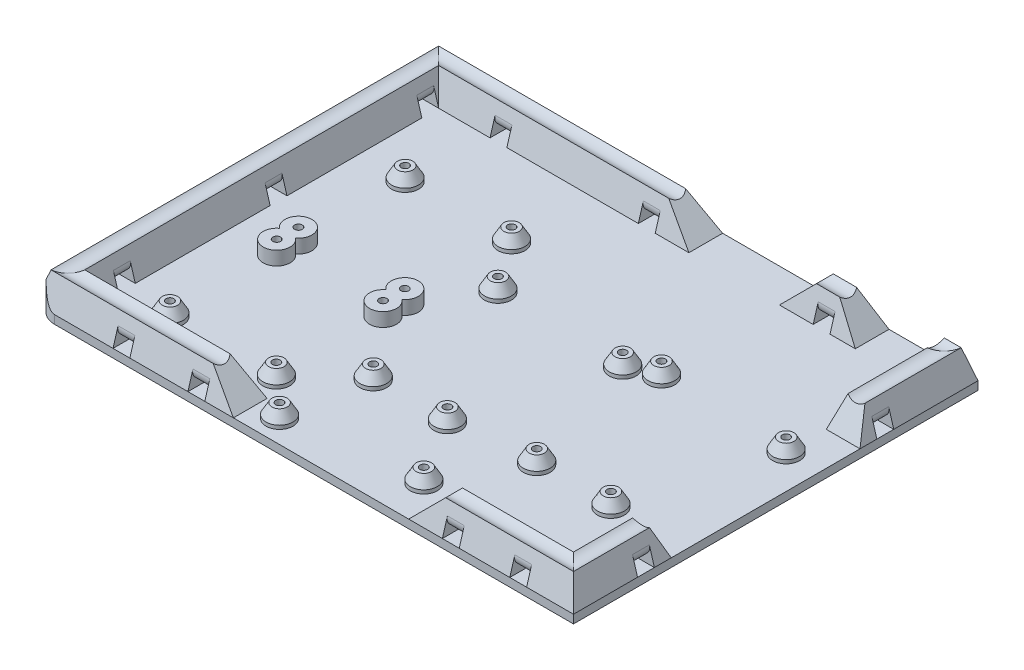
from build123d import *
from OCP.BRepFilletAPI import BRepFilletAPI_MakeChamfer

# Parameters (mm, degrees)
SKETCH1_W                       = 203.2
SKETCH1_H                       = 152.4
BOSS_EXTRUDE1_DEPTH             = 3.175
SKETCH2_R                       = 1.5875
SKETCH2_R_2                     = 1.5
CUT_EXTRUDE1_DEPTH              = 183.633442891
BOSS_EXTRUDE2_REACH             = 184.633
SKETCH3_R                       = 5.08
SKETCH3_R_2                     = 1.45
BOSS_EXTRUDE2_DIRECTION_2_DEPTH = 5.1816
CHAMFER1_SIZE                   = 3.81
CHAMFER1_SIZE2                  = 2.199704526
BOSS_EXTRUDE3_DEPTH             = 152.4
CUT_EXTRUDE3_REACH              = 252.771
SKETCH7_W                       = 6.35
SKETCH7_H                       = 2.54
CUT_EXTRUDE4_DEPTH              = 183.923220329
BOSS_EXTRUDE4_REACH             = 183.774
CUT_EXTRUDE5_REACH              = 203.769
CUT_EXTRUDE6_REACH              = 203.769
SKETCH11_W                      = 6.35
SKETCH11_H                      = 2.54
BOSS_EXTRUDE5_REACH             = 196.979
CUT_EXTRUDE7_REACH              = 203.769
SKETCH13_W                      = 6.35
SKETCH13_H                      = 2.54
BOSS_EXTRUDE6_START             = -62.103
BOSS_EXTRUDE6_DEPTH             = 62.103
CUT_EXTRUDE8_DEPTH              = 183.923220329
CUT_EXTRUDE9_REACH              = 203.769
SKETCH16_W                      = 6.35
SKETCH16_H                      = 2.54
CUT_EXTRUDE10_REACH             = 203.769
CUT_EXTRUDE11_REACH             = 203.769
BOSS_EXTRUDE7_REACH             = 177.617
BOSS_EXTRUDE8_REACH             = 172.699
CUT_EXTRUDE12_REACH             = 252.771
SKETCH21_W                      = 6.35
SKETCH21_H                      = 2.54
FILLET2_R                       = 3.048
SKETCH22_R                      = 1.5875
CUT_EXTRUDE13_DEPTH             = 12.7
CUT_EXTRUDE14_REACH             = 252.771
CUT_EXTRUDE16_REACH             = 203.769
CUT_EXTRUDE17_REACH             = 238.693
FILLET3_R                       = 7.62


with BuildPart() as part:
    # Sketch1 → Boss-Extrude1 (new body)
    with BuildSketch(Plane(origin=(0, 39.60898566, 0), x_dir=(-1, 0, 0), z_dir=(0, -1, 0))):
        with Locations((-19.300561031, -60.650093823)):
            Rectangle(SKETCH1_W, SKETCH1_H)
    extrude(amount=-BOSS_EXTRUDE1_DEPTH)

    # Sketch2 → Cut-Extrude1 (cut, through all)
    with BuildSketch(Plane(origin=(0, 42.78398566, 0), x_dir=(1, 0, 0), z_dir=(0, 1, 0))):
        with Locations(Location((65.147561031, -94.940093823, 0), (0, 0, 180))):
            Circle(SKETCH2_R)
        with Locations(Location((93.087561031, -94.940093823, 0), (0, 0, 180))):
            Circle(SKETCH2_R)
        with Locations(Location((60.067561031, -42.870093823, 0), (0, 0, 180))):
            Circle(SKETCH2_R)
        with Locations(Location((108.327561031, -44.140093823, 0), (0, 0, 180))):
            Circle(SKETCH2_R)
        with Locations(Location((49.907561031, -47.315093823, 0), (0, 0, 180))):
            Circle(SKETCH2_R)
        with Locations(Location((49.907561031, -122.245093823, 0), (0, 0, 180))):
            Circle(SKETCH2_R)
        with Locations(Location((34.667561031, -98.115093823, 0), (0, 0, 180))):
            Circle(SKETCH2_R)
        with Locations(Location((1.647561031, -128.341093823, 0), (0, 0, 180))):
            Circle(SKETCH2_R)
        with Locations(Location((6.727561031, -98.115093823, 0), (0, 0, 180))):
            Circle(SKETCH2_R)
        with Locations(Location((-12.119238969, -115.793493823, 0), (0, 0, 180))):
            Circle(SKETCH2_R_2)
        with Locations(Location((-12.119238969, -75.585293823, 0), (0, 0, 180))):
            Circle(SKETCH2_R_2)
        with Locations(Location((1.647561031, -46.045093823, 0), (0, 0, 180))):
            Circle(SKETCH2_R)
        with Locations(Location((-11.941438969, -67.558893823, 0), (0, 0, 180))):
            Circle(SKETCH2_R_2)
        with Locations(Location((-11.941438969, -27.350693823, 0), (0, 0, 180))):
            Circle(SKETCH2_R_2)
        with Locations(Location((-52.200438969, -115.793493823, 0), (0, 0, 180))):
            Circle(SKETCH2_R_2)
        with Locations(Location((-52.200438969, -75.585293823, 0), (0, 0, 180))):
            Circle(SKETCH2_R_2)
        with Locations(Location((-52.022638969, -67.558893823, 0), (0, 0, 180))):
            Circle(SKETCH2_R_2)
        with Locations(Location((-52.022638969, -27.350693823, 0), (0, 0, 180))):
            Circle(SKETCH2_R_2)
    extrude(amount=-CUT_EXTRUDE1_DEPTH, mode=Mode.SUBTRACT)

    # Boss-Extrude2: up to this face of the body (flat: up to its plane)
    boss_extrude2_end = Plane(part.part.faces().sort_by_distance((19.323360427, 39.60898566, 60.575990854))[0])
    # Sketch3 → Boss-Extrude2 (add, up to the picked face)
    with BuildSketch(Plane(origin=(0, 42.78398566, 0), x_dir=(1, 0, 0), z_dir=(0, 1, 0)), mode=Mode.PRIVATE) as boss_extrude2_sk1:
        with Locations(Location((-52.022638969, -27.350693823, 0), (0, 0, 180))):
            Circle(SKETCH3_R)
        with Locations(Location((-52.022638969, -27.350693823, 0), (0, 0, 180))):
            Circle(SKETCH3_R_2, mode=Mode.SUBTRACT)
    boss_extrude2_tool1 = split(extrude(boss_extrude2_sk1.sketch, amount=-BOSS_EXTRUDE2_REACH, mode=Mode.PRIVATE), bisect_by=boss_extrude2_end, keep=Keep.BOTH, mode=Mode.PRIVATE)
    # Sketch3 → Boss-Extrude2 (add, up to the picked face)
    with BuildSketch(Plane(origin=(0, 42.78398566, 0), x_dir=(1, 0, 0), z_dir=(0, 1, 0)), mode=Mode.PRIVATE) as boss_extrude2_sk2:
        with Locations(Location((-11.941438969, -27.350693823, 0), (0, 0, 180))):
            Circle(SKETCH3_R)
        with Locations(Location((-11.941438969, -27.350693823, 0), (0, 0, 180))):
            Circle(SKETCH3_R_2, mode=Mode.SUBTRACT)
    boss_extrude2_tool2 = split(extrude(boss_extrude2_sk2.sketch, amount=-BOSS_EXTRUDE2_REACH, mode=Mode.PRIVATE), bisect_by=boss_extrude2_end, keep=Keep.BOTH, mode=Mode.PRIVATE)
    # Sketch3 → Boss-Extrude2 (add, up to the picked face)
    with BuildSketch(Plane(origin=(0, 42.78398566, 0), x_dir=(1, 0, 0), z_dir=(0, 1, 0)), mode=Mode.PRIVATE) as boss_extrude2_sk3:
        with Locations(Location((1.647561031, -46.045093823, 0), (0, 0, 180))):
            Circle(SKETCH3_R)
        with Locations(Location((1.647561031, -46.045093823, 0), (0, 0, 180))):
            Circle(SKETCH3_R_2, mode=Mode.SUBTRACT)
    boss_extrude2_tool3 = split(extrude(boss_extrude2_sk3.sketch, amount=-BOSS_EXTRUDE2_REACH, mode=Mode.PRIVATE), bisect_by=boss_extrude2_end, keep=Keep.BOTH, mode=Mode.PRIVATE)
    # Sketch3 → Boss-Extrude2 (add, up to the picked face)
    with BuildSketch(Plane(origin=(0, 42.78398566, 0), x_dir=(1, 0, 0), z_dir=(0, 1, 0)), mode=Mode.PRIVATE) as boss_extrude2_sk4:
        with Locations(Location((49.907561031, -47.315093823, 0), (0, 0, 180))):
            Circle(SKETCH3_R)
        with Locations(Location((49.907561031, -47.315093823, 0), (0, 0, 180))):
            Circle(SKETCH3_R_2, mode=Mode.SUBTRACT)
    boss_extrude2_tool4 = split(extrude(boss_extrude2_sk4.sketch, amount=-BOSS_EXTRUDE2_REACH, mode=Mode.PRIVATE), bisect_by=boss_extrude2_end, keep=Keep.BOTH, mode=Mode.PRIVATE)
    # Sketch3 → Boss-Extrude2 (add, up to the picked face)
    with BuildSketch(Plane(origin=(0, 42.78398566, 0), x_dir=(1, 0, 0), z_dir=(0, 1, 0)), mode=Mode.PRIVATE) as boss_extrude2_sk5:
        with Locations(Location((108.327561031, -44.140093823, 0), (0, 0, 180))):
            Circle(SKETCH3_R)
        with Locations(Location((108.327561031, -44.140093823, 0), (0, 0, 180))):
            Circle(SKETCH3_R_2, mode=Mode.SUBTRACT)
    boss_extrude2_tool5 = split(extrude(boss_extrude2_sk5.sketch, amount=-BOSS_EXTRUDE2_REACH, mode=Mode.PRIVATE), bisect_by=boss_extrude2_end, keep=Keep.BOTH, mode=Mode.PRIVATE)
    # Sketch3 → Boss-Extrude2 (add, up to the picked face)
    with BuildSketch(Plane(origin=(0, 42.78398566, 0), x_dir=(1, 0, 0), z_dir=(0, 1, 0)), mode=Mode.PRIVATE) as boss_extrude2_sk6:
        with Locations(Location((93.087561031, -94.940093823, 0), (0, 0, 180))):
            Circle(SKETCH3_R)
        with Locations(Location((93.087561031, -94.940093823, 0), (0, 0, 180))):
            Circle(SKETCH3_R_2, mode=Mode.SUBTRACT)
    boss_extrude2_tool6 = split(extrude(boss_extrude2_sk6.sketch, amount=-BOSS_EXTRUDE2_REACH, mode=Mode.PRIVATE), bisect_by=boss_extrude2_end, keep=Keep.BOTH, mode=Mode.PRIVATE)
    # Sketch3 → Boss-Extrude2 (add, up to the picked face)
    with BuildSketch(Plane(origin=(0, 42.78398566, 0), x_dir=(1, 0, 0), z_dir=(0, 1, 0)), mode=Mode.PRIVATE) as boss_extrude2_sk7:
        with Locations(Location((65.147561031, -94.940093823, 0), (0, 0, 180))):
            Circle(SKETCH3_R)
        with Locations(Location((65.147561031, -94.940093823, 0), (0, 0, 180))):
            Circle(SKETCH3_R_2, mode=Mode.SUBTRACT)
    boss_extrude2_tool7 = split(extrude(boss_extrude2_sk7.sketch, amount=-BOSS_EXTRUDE2_REACH, mode=Mode.PRIVATE), bisect_by=boss_extrude2_end, keep=Keep.BOTH, mode=Mode.PRIVATE)
    # Sketch3 → Boss-Extrude2 (add, up to the picked face)
    with BuildSketch(Plane(origin=(0, 42.78398566, 0), x_dir=(1, 0, 0), z_dir=(0, 1, 0)), mode=Mode.PRIVATE) as boss_extrude2_sk8:
        with Locations(Location((60.067561031, -42.870093823, 0), (0, 0, 180))):
            Circle(SKETCH3_R)
        with Locations(Location((60.067561031, -42.870093823, 0), (0, 0, 180))):
            Circle(SKETCH3_R_2, mode=Mode.SUBTRACT)
    boss_extrude2_tool8 = split(extrude(boss_extrude2_sk8.sketch, amount=-BOSS_EXTRUDE2_REACH, mode=Mode.PRIVATE), bisect_by=boss_extrude2_end, keep=Keep.BOTH, mode=Mode.PRIVATE)
    # Sketch3 → Boss-Extrude2 (add, up to the picked face)
    with BuildSketch(Plane(origin=(0, 42.78398566, 0), x_dir=(1, 0, 0), z_dir=(0, 1, 0)), mode=Mode.PRIVATE) as boss_extrude2_sk9:
        with Locations((-11.941438969, -67.558893823)):
            Circle(SKETCH3_R)
        with Locations(Location((-11.941438969, -67.558893823, 0), (0, 0, 180))):
            Circle(SKETCH3_R_2, mode=Mode.SUBTRACT)
    boss_extrude2_tool9 = split(extrude(boss_extrude2_sk9.sketch, amount=-BOSS_EXTRUDE2_REACH, mode=Mode.PRIVATE), bisect_by=boss_extrude2_end, keep=Keep.BOTH, mode=Mode.PRIVATE)
    # Sketch3 → Boss-Extrude2 (add, up to the picked face)
    with BuildSketch(Plane(origin=(0, 42.78398566, 0), x_dir=(1, 0, 0), z_dir=(0, 1, 0)), mode=Mode.PRIVATE) as boss_extrude2_sk10:
        with Locations((-12.119238969, -75.585293823)):
            Circle(SKETCH3_R)
        with Locations(Location((-12.119238969, -75.585293823, 0), (0, 0, 180))):
            Circle(SKETCH3_R_2, mode=Mode.SUBTRACT)
    boss_extrude2_tool10 = split(extrude(boss_extrude2_sk10.sketch, amount=-BOSS_EXTRUDE2_REACH, mode=Mode.PRIVATE), bisect_by=boss_extrude2_end, keep=Keep.BOTH, mode=Mode.PRIVATE)
    # Sketch3 → Boss-Extrude2 (add, up to the picked face)
    with BuildSketch(Plane(origin=(0, 42.78398566, 0), x_dir=(1, 0, 0), z_dir=(0, 1, 0)), mode=Mode.PRIVATE) as boss_extrude2_sk11:
        with Locations((-52.022638969, -67.558893823)):
            Circle(SKETCH3_R)
        with Locations(Location((-52.022638969, -67.558893823, 0), (0, 0, 180))):
            Circle(SKETCH3_R_2, mode=Mode.SUBTRACT)
    boss_extrude2_tool11 = split(extrude(boss_extrude2_sk11.sketch, amount=-BOSS_EXTRUDE2_REACH, mode=Mode.PRIVATE), bisect_by=boss_extrude2_end, keep=Keep.BOTH, mode=Mode.PRIVATE)
    # Sketch3 → Boss-Extrude2 (add, up to the picked face)
    with BuildSketch(Plane(origin=(0, 42.78398566, 0), x_dir=(1, 0, 0), z_dir=(0, 1, 0)), mode=Mode.PRIVATE) as boss_extrude2_sk12:
        with Locations((-52.200438969, -75.585293823)):
            Circle(SKETCH3_R)
        with Locations(Location((-52.200438969, -75.585293823, 0), (0, 0, 180))):
            Circle(SKETCH3_R_2, mode=Mode.SUBTRACT)
    boss_extrude2_tool12 = split(extrude(boss_extrude2_sk12.sketch, amount=-BOSS_EXTRUDE2_REACH, mode=Mode.PRIVATE), bisect_by=boss_extrude2_end, keep=Keep.BOTH, mode=Mode.PRIVATE)
    # Sketch3 → Boss-Extrude2 (add, up to the picked face)
    with BuildSketch(Plane(origin=(0, 42.78398566, 0), x_dir=(1, 0, 0), z_dir=(0, 1, 0)), mode=Mode.PRIVATE) as boss_extrude2_sk13:
        with Locations(Location((-52.200438969, -115.793493823, 0), (0, 0, 180))):
            Circle(SKETCH3_R)
        with Locations(Location((-52.200438969, -115.793493823, 0), (0, 0, 180))):
            Circle(SKETCH3_R_2, mode=Mode.SUBTRACT)
    boss_extrude2_tool13 = split(extrude(boss_extrude2_sk13.sketch, amount=-BOSS_EXTRUDE2_REACH, mode=Mode.PRIVATE), bisect_by=boss_extrude2_end, keep=Keep.BOTH, mode=Mode.PRIVATE)
    # Sketch3 → Boss-Extrude2 (add, up to the picked face)
    with BuildSketch(Plane(origin=(0, 42.78398566, 0), x_dir=(1, 0, 0), z_dir=(0, 1, 0)), mode=Mode.PRIVATE) as boss_extrude2_sk14:
        with Locations(Location((-12.119238969, -115.793493823, 0), (0, 0, 180))):
            Circle(SKETCH3_R)
        with Locations(Location((-12.119238969, -115.793493823, 0), (0, 0, 180))):
            Circle(SKETCH3_R_2, mode=Mode.SUBTRACT)
    boss_extrude2_tool14 = split(extrude(boss_extrude2_sk14.sketch, amount=-BOSS_EXTRUDE2_REACH, mode=Mode.PRIVATE), bisect_by=boss_extrude2_end, keep=Keep.BOTH, mode=Mode.PRIVATE)
    # Sketch3 → Boss-Extrude2 (add, up to the picked face)
    with BuildSketch(Plane(origin=(0, 42.78398566, 0), x_dir=(1, 0, 0), z_dir=(0, 1, 0)), mode=Mode.PRIVATE) as boss_extrude2_sk15:
        with Locations(Location((6.727561031, -98.115093823, 0), (0, 0, 180))):
            Circle(SKETCH3_R)
        with Locations(Location((6.727561031, -98.115093823, 0), (0, 0, 180))):
            Circle(SKETCH3_R_2, mode=Mode.SUBTRACT)
    boss_extrude2_tool15 = split(extrude(boss_extrude2_sk15.sketch, amount=-BOSS_EXTRUDE2_REACH, mode=Mode.PRIVATE), bisect_by=boss_extrude2_end, keep=Keep.BOTH, mode=Mode.PRIVATE)
    # Sketch3 → Boss-Extrude2 (add, up to the picked face)
    with BuildSketch(Plane(origin=(0, 42.78398566, 0), x_dir=(1, 0, 0), z_dir=(0, 1, 0)), mode=Mode.PRIVATE) as boss_extrude2_sk16:
        with Locations(Location((34.667561031, -98.115093823, 0), (0, 0, 180))):
            Circle(SKETCH3_R)
        with Locations(Location((34.667561031, -98.115093823, 0), (0, 0, 180))):
            Circle(SKETCH3_R_2, mode=Mode.SUBTRACT)
    boss_extrude2_tool16 = split(extrude(boss_extrude2_sk16.sketch, amount=-BOSS_EXTRUDE2_REACH, mode=Mode.PRIVATE), bisect_by=boss_extrude2_end, keep=Keep.BOTH, mode=Mode.PRIVATE)
    # Sketch3 → Boss-Extrude2 (add, up to the picked face)
    with BuildSketch(Plane(origin=(0, 42.78398566, 0), x_dir=(1, 0, 0), z_dir=(0, 1, 0)), mode=Mode.PRIVATE) as boss_extrude2_sk17:
        with Locations(Location((49.907561031, -122.245093823, 0), (0, 0, 180))):
            Circle(SKETCH3_R)
        with Locations(Location((49.907561031, -122.245093823, 0), (0, 0, 180))):
            Circle(SKETCH3_R_2, mode=Mode.SUBTRACT)
    boss_extrude2_tool17 = split(extrude(boss_extrude2_sk17.sketch, amount=-BOSS_EXTRUDE2_REACH, mode=Mode.PRIVATE), bisect_by=boss_extrude2_end, keep=Keep.BOTH, mode=Mode.PRIVATE)
    # Sketch3 → Boss-Extrude2 (add, up to the picked face)
    with BuildSketch(Plane(origin=(0, 42.78398566, 0), x_dir=(1, 0, 0), z_dir=(0, 1, 0)), mode=Mode.PRIVATE) as boss_extrude2_sk18:
        with Locations(Location((1.647561031, -128.341093823, 0), (0, 0, 180))):
            Circle(SKETCH3_R)
        with Locations(Location((1.647561031, -128.341093823, 0), (0, 0, 180))):
            Circle(SKETCH3_R_2, mode=Mode.SUBTRACT)
    boss_extrude2_tool18 = split(extrude(boss_extrude2_sk18.sketch, amount=-BOSS_EXTRUDE2_REACH, mode=Mode.PRIVATE), bisect_by=boss_extrude2_end, keep=Keep.BOTH, mode=Mode.PRIVATE)
    add(boss_extrude2_tool1.solids().sort_by(Axis((-47.086323, 42.783986, 27.350694), (0, -1, 0)))[0])
    add(boss_extrude2_tool2.solids().sort_by(Axis((-7.005123, 42.783986, 27.350694), (0, -1, 0)))[0])
    add(boss_extrude2_tool3.solids().sort_by(Axis((6.583877, 42.783986, 46.045094), (0, -1, 0)))[0])
    add(boss_extrude2_tool4.solids().sort_by(Axis((54.843877, 42.783986, 47.315094), (0, -1, 0)))[0])
    add(boss_extrude2_tool5.solids().sort_by(Axis((113.263877, 42.783986, 44.140094), (0, -1, 0)))[0])
    add(boss_extrude2_tool6.solids().sort_by(Axis((98.023877, 42.783986, 94.940094), (0, -1, 0)))[0])
    add(boss_extrude2_tool7.solids().sort_by(Axis((70.083877, 42.783986, 94.940094), (0, -1, 0)))[0])
    add(boss_extrude2_tool8.solids().sort_by(Axis((65.003877, 42.783986, 42.870094), (0, -1, 0)))[0])
    add(boss_extrude2_tool9.solids().sort_by(Axis((-16.877755, 42.783986, 67.558894), (0, -1, 0)))[0])
    add(boss_extrude2_tool10.solids().sort_by(Axis((-17.055555, 42.783986, 75.585294), (0, -1, 0)))[0])
    add(boss_extrude2_tool11.solids().sort_by(Axis((-56.958955, 42.783986, 67.558894), (0, -1, 0)))[0])
    add(boss_extrude2_tool12.solids().sort_by(Axis((-57.136755, 42.783986, 75.585294), (0, -1, 0)))[0])
    add(boss_extrude2_tool13.solids().sort_by(Axis((-47.264123, 42.783986, 115.793494), (0, -1, 0)))[0])
    add(boss_extrude2_tool14.solids().sort_by(Axis((-7.182923, 42.783986, 115.793494), (0, -1, 0)))[0])
    add(boss_extrude2_tool15.solids().sort_by(Axis((11.663877, 42.783986, 98.115094), (0, -1, 0)))[0])
    add(boss_extrude2_tool16.solids().sort_by(Axis((39.603877, 42.783986, 98.115094), (0, -1, 0)))[0])
    add(boss_extrude2_tool17.solids().sort_by(Axis((54.843877, 42.783986, 122.245094), (0, -1, 0)))[0])
    add(boss_extrude2_tool18.solids().sort_by(Axis((6.583877, 42.783986, 128.341094), (0, -1, 0)))[0])

    # Sketch3 → Boss-Extrude2 direction 2 (add)
    # profile 1 of 18: a face of its own
    with BuildSketch(Plane(origin=(0, 42.78398566, 0), x_dir=(1, 0, 0), z_dir=(0, 1, 0))):
        with Locations(Location((-52.022638969, -27.350693823, 0), (0, 0, 180))):
            Circle(SKETCH3_R)
        with Locations(Location((-52.022638969, -27.350693823, 0), (0, 0, 180))):
            Circle(SKETCH3_R_2, mode=Mode.SUBTRACT)
    # profile 2 of 18: a face of its own
    with BuildSketch(Plane(origin=(0, 42.78398566, 0), x_dir=(1, 0, 0), z_dir=(0, 1, 0))):
        with Locations(Location((-11.941438969, -27.350693823, 0), (0, 0, 180))):
            Circle(SKETCH3_R)
        with Locations(Location((-11.941438969, -27.350693823, 0), (0, 0, 180))):
            Circle(SKETCH3_R_2, mode=Mode.SUBTRACT)
    # profile 3 of 18: a face of its own
    with BuildSketch(Plane(origin=(0, 42.78398566, 0), x_dir=(1, 0, 0), z_dir=(0, 1, 0))):
        with Locations(Location((1.647561031, -46.045093823, 0), (0, 0, 180))):
            Circle(SKETCH3_R)
        with Locations(Location((1.647561031, -46.045093823, 0), (0, 0, 180))):
            Circle(SKETCH3_R_2, mode=Mode.SUBTRACT)
    # profile 4 of 18: a face of its own
    with BuildSketch(Plane(origin=(0, 42.78398566, 0), x_dir=(1, 0, 0), z_dir=(0, 1, 0))):
        with Locations(Location((49.907561031, -47.315093823, 0), (0, 0, 180))):
            Circle(SKETCH3_R)
        with Locations(Location((49.907561031, -47.315093823, 0), (0, 0, 180))):
            Circle(SKETCH3_R_2, mode=Mode.SUBTRACT)
    # profile 5 of 18: a face of its own
    with BuildSketch(Plane(origin=(0, 42.78398566, 0), x_dir=(1, 0, 0), z_dir=(0, 1, 0))):
        with Locations(Location((108.327561031, -44.140093823, 0), (0, 0, 180))):
            Circle(SKETCH3_R)
        with Locations(Location((108.327561031, -44.140093823, 0), (0, 0, 180))):
            Circle(SKETCH3_R_2, mode=Mode.SUBTRACT)
    # profile 6 of 18: a face of its own
    with BuildSketch(Plane(origin=(0, 42.78398566, 0), x_dir=(1, 0, 0), z_dir=(0, 1, 0))):
        with Locations(Location((93.087561031, -94.940093823, 0), (0, 0, 180))):
            Circle(SKETCH3_R)
        with Locations(Location((93.087561031, -94.940093823, 0), (0, 0, 180))):
            Circle(SKETCH3_R_2, mode=Mode.SUBTRACT)
    # profile 7 of 18: a face of its own
    with BuildSketch(Plane(origin=(0, 42.78398566, 0), x_dir=(1, 0, 0), z_dir=(0, 1, 0))):
        with Locations(Location((65.147561031, -94.940093823, 0), (0, 0, 180))):
            Circle(SKETCH3_R)
        with Locations(Location((65.147561031, -94.940093823, 0), (0, 0, 180))):
            Circle(SKETCH3_R_2, mode=Mode.SUBTRACT)
    # profile 8 of 18: a face of its own
    with BuildSketch(Plane(origin=(0, 42.78398566, 0), x_dir=(1, 0, 0), z_dir=(0, 1, 0))):
        with Locations(Location((60.067561031, -42.870093823, 0), (0, 0, 180))):
            Circle(SKETCH3_R)
        with Locations(Location((60.067561031, -42.870093823, 0), (0, 0, 180))):
            Circle(SKETCH3_R_2, mode=Mode.SUBTRACT)
    # profile 9 of 18: a face of its own
    with BuildSketch(Plane(origin=(0, 42.78398566, 0), x_dir=(1, 0, 0), z_dir=(0, 1, 0))):
        with Locations((-11.941438969, -67.558893823)):
            Circle(SKETCH3_R)
        with Locations(Location((-11.941438969, -67.558893823, 0), (0, 0, 180))):
            Circle(SKETCH3_R_2, mode=Mode.SUBTRACT)
    # profile 10 of 18: a face of its own
    with BuildSketch(Plane(origin=(0, 42.78398566, 0), x_dir=(1, 0, 0), z_dir=(0, 1, 0))):
        with Locations((-12.119238969, -75.585293823)):
            Circle(SKETCH3_R)
        with Locations(Location((-12.119238969, -75.585293823, 0), (0, 0, 180))):
            Circle(SKETCH3_R_2, mode=Mode.SUBTRACT)
    # profile 11 of 18: a face of its own
    with BuildSketch(Plane(origin=(0, 42.78398566, 0), x_dir=(1, 0, 0), z_dir=(0, 1, 0))):
        with Locations((-52.022638969, -67.558893823)):
            Circle(SKETCH3_R)
        with Locations(Location((-52.022638969, -67.558893823, 0), (0, 0, 180))):
            Circle(SKETCH3_R_2, mode=Mode.SUBTRACT)
    # profile 12 of 18: a face of its own
    with BuildSketch(Plane(origin=(0, 42.78398566, 0), x_dir=(1, 0, 0), z_dir=(0, 1, 0))):
        with Locations((-52.200438969, -75.585293823)):
            Circle(SKETCH3_R)
        with Locations(Location((-52.200438969, -75.585293823, 0), (0, 0, 180))):
            Circle(SKETCH3_R_2, mode=Mode.SUBTRACT)
    # profile 13 of 18: a face of its own
    with BuildSketch(Plane(origin=(0, 42.78398566, 0), x_dir=(1, 0, 0), z_dir=(0, 1, 0))):
        with Locations(Location((-52.200438969, -115.793493823, 0), (0, 0, 180))):
            Circle(SKETCH3_R)
        with Locations(Location((-52.200438969, -115.793493823, 0), (0, 0, 180))):
            Circle(SKETCH3_R_2, mode=Mode.SUBTRACT)
    # profile 14 of 18: a face of its own
    with BuildSketch(Plane(origin=(0, 42.78398566, 0), x_dir=(1, 0, 0), z_dir=(0, 1, 0))):
        with Locations(Location((-12.119238969, -115.793493823, 0), (0, 0, 180))):
            Circle(SKETCH3_R)
        with Locations(Location((-12.119238969, -115.793493823, 0), (0, 0, 180))):
            Circle(SKETCH3_R_2, mode=Mode.SUBTRACT)
    # profile 15 of 18: a face of its own
    with BuildSketch(Plane(origin=(0, 42.78398566, 0), x_dir=(1, 0, 0), z_dir=(0, 1, 0))):
        with Locations(Location((6.727561031, -98.115093823, 0), (0, 0, 180))):
            Circle(SKETCH3_R)
        with Locations(Location((6.727561031, -98.115093823, 0), (0, 0, 180))):
            Circle(SKETCH3_R_2, mode=Mode.SUBTRACT)
    # profile 16 of 18: a face of its own
    with BuildSketch(Plane(origin=(0, 42.78398566, 0), x_dir=(1, 0, 0), z_dir=(0, 1, 0))):
        with Locations(Location((34.667561031, -98.115093823, 0), (0, 0, 180))):
            Circle(SKETCH3_R)
        with Locations(Location((34.667561031, -98.115093823, 0), (0, 0, 180))):
            Circle(SKETCH3_R_2, mode=Mode.SUBTRACT)
    # profile 17 of 18: a face of its own
    with BuildSketch(Plane(origin=(0, 42.78398566, 0), x_dir=(1, 0, 0), z_dir=(0, 1, 0))):
        with Locations(Location((49.907561031, -122.245093823, 0), (0, 0, 180))):
            Circle(SKETCH3_R)
        with Locations(Location((49.907561031, -122.245093823, 0), (0, 0, 180))):
            Circle(SKETCH3_R_2, mode=Mode.SUBTRACT)
    # profile 18 of 18: a face of its own
    with BuildSketch(Plane(origin=(0, 42.78398566, 0), x_dir=(1, 0, 0), z_dir=(0, 1, 0))):
        with Locations(Location((1.647561031, -128.341093823, 0), (0, 0, 180))):
            Circle(SKETCH3_R)
        with Locations(Location((1.647561031, -128.341093823, 0), (0, 0, 180))):
            Circle(SKETCH3_R_2, mode=Mode.SUBTRACT)
    extrude(amount=BOSS_EXTRUDE2_DIRECTION_2_DEPTH)

    # Chamfer1: one chamfer whose edges measure the first distance from different faces: ONE call of the kernel's chamfer builder (chamfer() names one face for all edges)
    chamfer1_edges_1 = [part.edges().sort_by_distance(p)[0] for p in [
        (98.167561031, 47.96558566, 94.940093823),
    ]]
    chamfer1_side_1 = [part.faces().sort_by_distance(p)[0] for p in [
        (98.167561031, 45.37478566, 94.940093823),
    ]]
    chamfer1_edges_2 = [part.edges().sort_by_distance(p)[0] for p in [
        (70.227561031, 47.96558566, 94.940093823),
    ]]
    chamfer1_side_2 = [part.faces().sort_by_distance(p)[0] for p in [
        (70.227561031, 45.37478566, 94.940093823),
    ]]
    chamfer1_edges_3 = [part.edges().sort_by_distance(p)[0] for p in [
        (54.987561031, 47.96558566, 47.315093823),
    ]]
    chamfer1_side_3 = [part.faces().sort_by_distance(p)[0] for p in [
        (54.987561031, 45.37478566, 47.315093823),
    ]]
    chamfer1_edges_4 = [part.edges().sort_by_distance(p)[0] for p in [
        (113.407561031, 47.96558566, 44.140093823),
    ]]
    chamfer1_side_4 = [part.faces().sort_by_distance(p)[0] for p in [
        (113.407561031, 45.37478566, 44.140093823),
    ]]
    chamfer1_edges_5 = [part.edges().sort_by_distance(p)[0] for p in [
        (65.147561031, 47.96558566, 42.870093823),
    ]]
    chamfer1_side_5 = [part.faces().sort_by_distance(p)[0] for p in [
        (65.147561031, 45.37478566, 42.870093823),
    ]]
    chamfer1_edges_6 = [part.edges().sort_by_distance(p)[0] for p in [
        (6.727561031, 47.96558566, 46.045093823),
    ]]
    chamfer1_side_6 = [part.faces().sort_by_distance(p)[0] for p in [
        (6.727561031, 45.37478566, 46.045093823),
    ]]
    chamfer1_edges_7 = [part.edges().sort_by_distance(p)[0] for p in [
        (-47.120438969, 47.96558566, 115.793493823),
    ]]
    chamfer1_side_7 = [part.faces().sort_by_distance(p)[0] for p in [
        (-47.120438969, 45.37478566, 115.793493823),
    ]]
    chamfer1_edges_8 = [part.edges().sort_by_distance(p)[0] for p in [
        (-7.039238969, 47.96558566, 115.793493823),
    ]]
    chamfer1_side_8 = [part.faces().sort_by_distance(p)[0] for p in [
        (-7.039238969, 45.37478566, 115.793493823),
    ]]
    chamfer1_edges_9 = [part.edges().sort_by_distance(p)[0] for p in [
        (11.807561031, 47.96558566, 98.115093823),
    ]]
    chamfer1_side_9 = [part.faces().sort_by_distance(p)[0] for p in [
        (11.807561031, 45.37478566, 98.115093823),
    ]]
    chamfer1_edges_10 = [part.edges().sort_by_distance(p)[0] for p in [
        (39.747561031, 47.96558566, 98.115093823),
    ]]
    chamfer1_side_10 = [part.faces().sort_by_distance(p)[0] for p in [
        (39.747561031, 45.37478566, 98.115093823),
    ]]
    chamfer1_edges_11 = [part.edges().sort_by_distance(p)[0] for p in [
        (6.727561031, 47.96558566, 128.341093823),
    ]]
    chamfer1_side_11 = [part.faces().sort_by_distance(p)[0] for p in [
        (6.727561031, 45.37478566, 128.341093823),
    ]]
    chamfer1_edges_12 = [part.edges().sort_by_distance(p)[0] for p in [
        (54.987561031, 47.96558566, 122.245093823),
    ]]
    chamfer1_side_12 = [part.faces().sort_by_distance(p)[0] for p in [
        (54.987561031, 45.37478566, 122.245093823),
    ]]
    chamfer1_edges_13 = [part.edges().sort_by_distance(p)[0] for p in [
        (-46.942638969, 47.96558566, 27.350693823),
    ]]
    chamfer1_side_13 = [part.faces().sort_by_distance(p)[0] for p in [
        (-46.942638969, 45.37478566, 27.350693823),
    ]]
    chamfer1_edges_14 = [part.edges().sort_by_distance(p)[0] for p in [
        (-6.861438969, 47.96558566, 27.350693823),
    ]]
    chamfer1_side_14 = [part.faces().sort_by_distance(p)[0] for p in [
        (-6.861438969, 45.37478566, 27.350693823),
    ]]
    chamfer1 = BRepFilletAPI_MakeChamfer(part.part.solid().wrapped)
    for e in chamfer1_edges_1:
        chamfer1.Add(CHAMFER1_SIZE, CHAMFER1_SIZE2, e.wrapped, chamfer1_side_1[0].wrapped)  # the first distance lies on this face
    for e in chamfer1_edges_2:
        chamfer1.Add(CHAMFER1_SIZE, CHAMFER1_SIZE2, e.wrapped, chamfer1_side_2[0].wrapped)  # the first distance lies on this face
    for e in chamfer1_edges_3:
        chamfer1.Add(CHAMFER1_SIZE, CHAMFER1_SIZE2, e.wrapped, chamfer1_side_3[0].wrapped)  # the first distance lies on this face
    for e in chamfer1_edges_4:
        chamfer1.Add(CHAMFER1_SIZE, CHAMFER1_SIZE2, e.wrapped, chamfer1_side_4[0].wrapped)  # the first distance lies on this face
    for e in chamfer1_edges_5:
        chamfer1.Add(CHAMFER1_SIZE, CHAMFER1_SIZE2, e.wrapped, chamfer1_side_5[0].wrapped)  # the first distance lies on this face
    for e in chamfer1_edges_6:
        chamfer1.Add(CHAMFER1_SIZE, CHAMFER1_SIZE2, e.wrapped, chamfer1_side_6[0].wrapped)  # the first distance lies on this face
    for e in chamfer1_edges_7:
        chamfer1.Add(CHAMFER1_SIZE, CHAMFER1_SIZE2, e.wrapped, chamfer1_side_7[0].wrapped)  # the first distance lies on this face
    for e in chamfer1_edges_8:
        chamfer1.Add(CHAMFER1_SIZE, CHAMFER1_SIZE2, e.wrapped, chamfer1_side_8[0].wrapped)  # the first distance lies on this face
    for e in chamfer1_edges_9:
        chamfer1.Add(CHAMFER1_SIZE, CHAMFER1_SIZE2, e.wrapped, chamfer1_side_9[0].wrapped)  # the first distance lies on this face
    for e in chamfer1_edges_10:
        chamfer1.Add(CHAMFER1_SIZE, CHAMFER1_SIZE2, e.wrapped, chamfer1_side_10[0].wrapped)  # the first distance lies on this face
    for e in chamfer1_edges_11:
        chamfer1.Add(CHAMFER1_SIZE, CHAMFER1_SIZE2, e.wrapped, chamfer1_side_11[0].wrapped)  # the first distance lies on this face
    for e in chamfer1_edges_12:
        chamfer1.Add(CHAMFER1_SIZE, CHAMFER1_SIZE2, e.wrapped, chamfer1_side_12[0].wrapped)  # the first distance lies on this face
    for e in chamfer1_edges_13:
        chamfer1.Add(CHAMFER1_SIZE, CHAMFER1_SIZE2, e.wrapped, chamfer1_side_13[0].wrapped)  # the first distance lies on this face
    for e in chamfer1_edges_14:
        chamfer1.Add(CHAMFER1_SIZE, CHAMFER1_SIZE2, e.wrapped, chamfer1_side_14[0].wrapped)  # the first distance lies on this face
    add(Compound.cast(chamfer1.Shape()), mode=Mode.REPLACE)

    # Sketch6 → Boss-Extrude3 (add)
    with BuildSketch(Plane.XY.offset(136.850093823)):
        with BuildLine():
            Line((-82.299438969, 42.78398566), (-79.124438969, 53.554811931))
            ThreePointArc((-79.124438969, 53.554811931), (-75.949438969, 52.44038566), (-72.774438969, 53.554811931))
            Line((-72.774438969, 53.554811931), (-69.599438969, 42.78398566))
            Line((-69.599438969, 42.78398566), (-82.299438969, 42.78398566))
        make_face()
    extrude(amount=-BOSS_EXTRUDE3_DEPTH)

    # Cut-Extrude3: up to this plane
    cut_extrude3_end = Plane(origin=(-72.774438969, 53.554811931, -32.202254316), z_dir=(0.9591939243410956, 0.28274903272536345, 0))
    # Sketch7 → Cut-Extrude3 (cut, up to the surface)
    with BuildSketch(Plane.ZY.offset(82.299438969), mode=Mode.PRIVATE) as cut_extrude3_sk1:
        with Locations((0.325093823, 44.05398566)):
            Rectangle(SKETCH7_W, SKETCH7_H)
    cut_extrude3_tool1 = split(extrude(cut_extrude3_sk1.sketch, amount=-CUT_EXTRUDE3_REACH, mode=Mode.PRIVATE), bisect_by=cut_extrude3_end, keep=Keep.BOTH, mode=Mode.PRIVATE)
    add(cut_extrude3_tool1.solids().sort_by_distance((-82.299439, 44.053986, 0.325094))[0], mode=Mode.SUBTRACT)
    # Sketch7 → Cut-Extrude3 (cut, up to the surface)
    with BuildSketch(Plane.ZY.offset(82.299438969), mode=Mode.PRIVATE) as cut_extrude3_sk2:
        with Locations((57.475093823, 44.05398566)):
            Rectangle(SKETCH7_W, SKETCH7_H)
    cut_extrude3_tool2 = split(extrude(cut_extrude3_sk2.sketch, amount=-CUT_EXTRUDE3_REACH, mode=Mode.PRIVATE), bisect_by=cut_extrude3_end, keep=Keep.BOTH, mode=Mode.PRIVATE)
    add(cut_extrude3_tool2.solids().sort_by_distance((-82.299439, 44.053986, 57.475094))[0], mode=Mode.SUBTRACT)
    # Sketch7 → Cut-Extrude3 (cut, up to the surface)
    with BuildSketch(Plane.ZY.offset(82.299438969), mode=Mode.PRIVATE) as cut_extrude3_sk3:
        with Locations((114.625093823, 44.05398566)):
            Rectangle(SKETCH7_W, SKETCH7_H)
    cut_extrude3_tool3 = split(extrude(cut_extrude3_sk3.sketch, amount=-CUT_EXTRUDE3_REACH, mode=Mode.PRIVATE), bisect_by=cut_extrude3_end, keep=Keep.BOTH, mode=Mode.PRIVATE)
    add(cut_extrude3_tool3.solids().sort_by_distance((-82.299439, 44.053986, 114.625094))[0], mode=Mode.SUBTRACT)

    # Sketch8 → Cut-Extrude4 (cut, through all)
    with BuildSketch(Plane(origin=(0, 42.78398566, 0), x_dir=(1, 0, 0), z_dir=(0, 1, 0))):
        Polygon((-82.299438969, 15.549906177), (-52.076107899, 15.549906177), (-52.076107899, -14.673424893), align=None)
        Polygon((-82.299438969, -136.850093823), (-66.094424278, -136.850093823), (-66.094424278, -120.645079132), align=None)
    extrude(amount=CUT_EXTRUDE4_DEPTH, mode=Mode.SUBTRACT)

    # Boss-Extrude4: up to this face of the body (flat: up to its plane)
    boss_extrude4_end = Plane(part.part.faces().sort_by_distance((-75.949438969, 47.297511342, -9.199906177))[0])
    # Sketch9 → Boss-Extrude4 (add, up to the picked face)
    with BuildSketch(Plane.ZY.offset(-24.685361031), mode=Mode.PRIVATE) as boss_extrude4_sk1:
        with BuildLine():
            Line((-15.549906177, 42.78398566), (-2.849906177, 42.78398566))
            Line((-2.849906177, 42.78398566), (-6.024906177, 53.554811931))
            ThreePointArc((-6.024906177, 53.554811931), (-9.199906177, 52.44038566), (-12.374906177, 53.554811931))
            Line((-12.374906177, 53.554811931), (-15.549906177, 42.78398566))
        make_face()
    boss_extrude4_tool1 = split(extrude(boss_extrude4_sk1.sketch, amount=BOSS_EXTRUDE4_REACH, mode=Mode.PRIVATE), bisect_by=boss_extrude4_end, keep=Keep.BOTH, mode=Mode.PRIVATE)
    add(boss_extrude4_tool1.solids().sort_by(Axis((24.685361, 47.297511, -9.199906), (-1, 0, 0)))[0])

    # Cut-Extrude5: up to this plane
    cut_extrude5_end = Plane(origin=(-96.050601331, 42.78398566, -2.849906177), z_dir=(0, -0.28274903272537094, -0.9591939243410934))
    # Sketch10 → Cut-Extrude5 (cut, up to the surface)
    with BuildSketch(Plane(origin=(0, 0, -15.549906177), x_dir=(-1, 0, 0), z_dir=(0, 0, -1)), mode=Mode.PRIVATE) as cut_extrude5_sk1:
        Polygon((-24.685361031, 42.78398566), (-24.685361031, 53.554811931), (-13.91453476, 53.554811931), align=None)
    cut_extrude5_tool1 = split(extrude(cut_extrude5_sk1.sketch, amount=-CUT_EXTRUDE5_REACH, mode=Mode.PRIVATE), bisect_by=cut_extrude5_end, keep=Keep.BOTH, mode=Mode.PRIVATE)
    add(cut_extrude5_tool1.solids().sort_by_distance((21.095086, 49.964537, -15.549906))[0], mode=Mode.SUBTRACT)

    # Cut-Extrude6: up to this plane
    cut_extrude6_end = Plane(origin=(-96.050601331, 42.78398566, -2.849906177), z_dir=(0, -0.28274903272537094, -0.9591939243410934))
    # Sketch11 → Cut-Extrude6 (cut, up to the surface)
    with BuildSketch(Plane(origin=(0, 0, -15.549906177), x_dir=(-1, 0, 0), z_dir=(0, 0, -1)), mode=Mode.PRIVATE) as cut_extrude6_sk1:
        with Locations((-8.810361031, 44.05398566)):
            Rectangle(SKETCH11_W, SKETCH11_H)
    cut_extrude6_tool1 = split(extrude(cut_extrude6_sk1.sketch, amount=-CUT_EXTRUDE6_REACH, mode=Mode.PRIVATE), bisect_by=cut_extrude6_end, keep=Keep.BOTH, mode=Mode.PRIVATE)
    add(cut_extrude6_tool1.solids().sort_by_distance((8.810361, 44.053986, -15.549906))[0], mode=Mode.SUBTRACT)
    # Sketch11 → Cut-Extrude6 (cut, up to the surface)
    with BuildSketch(Plane(origin=(0, 0, -15.549906177), x_dir=(-1, 0, 0), z_dir=(0, 0, -1)), mode=Mode.PRIVATE) as cut_extrude6_sk2:
        with Locations((47.069638969, 44.05398566)):
            Rectangle(SKETCH11_W, SKETCH11_H)
    cut_extrude6_tool2 = split(extrude(cut_extrude6_sk2.sketch, amount=-CUT_EXTRUDE6_REACH, mode=Mode.PRIVATE), bisect_by=cut_extrude6_end, keep=Keep.BOTH, mode=Mode.PRIVATE)
    add(cut_extrude6_tool2.solids().sort_by_distance((-47.069639, 44.053986, -15.549906))[0], mode=Mode.SUBTRACT)

    # Boss-Extrude5: up to this face of the body (flat: up to its plane)
    boss_extrude5_end = Plane(part.part.faces().sort_by_distance((-75.949438969, 47.297511342, 130.500093823))[0])
    # Sketch12 → Boss-Extrude5 (add, up to the picked face)
    with BuildSketch(Plane(origin=(-7.242438969, 0, 0), x_dir=(0, 0, -1), z_dir=(1, 0, 0)), mode=Mode.PRIVATE) as boss_extrude5_sk1:
        with BuildLine():
            Line((-133.675093823, 53.554811931), (-136.850093823, 42.78398566))
            Line((-136.850093823, 42.78398566), (-124.150093823, 42.78398566))
            Line((-124.150093823, 42.78398566), (-127.325093823, 53.554811931))
            ThreePointArc((-127.325093823, 53.554811931), (-130.500093823, 52.44038566), (-133.675093823, 53.554811931))
        make_face()
    boss_extrude5_tool1 = split(extrude(boss_extrude5_sk1.sketch, amount=-BOSS_EXTRUDE5_REACH, mode=Mode.PRIVATE), bisect_by=boss_extrude5_end, keep=Keep.BOTH, mode=Mode.PRIVATE)
    add(boss_extrude5_tool1.solids().sort_by(Axis((-7.242439, 47.297511, 130.500094), (-1, 0, 0)))[0])

    # Sketch13 → Cut-Extrude7 (cut, up to next)
    with BuildSketch(Plane.XY.offset(136.850093823), mode=Mode.PRIVATE) as cut_extrude7_sk1:
        Polygon((-7.242438969, 42.78398566), (-7.242438969, 53.554811931), (-18.01326524, 53.554811931), align=None)
    cut_extrude7_tool1 = extrude(cut_extrude7_sk1.sketch, amount=-CUT_EXTRUDE7_REACH, mode=Mode.PRIVATE) & part.part
    # Sketch13 → Cut-Extrude7 (cut, up to next)
    with BuildSketch(Plane.XY.offset(136.850093823), mode=Mode.PRIVATE) as cut_extrude7_sk2:
        with Locations((-49.409438969, 44.05398566)):
            Rectangle(SKETCH13_W, SKETCH13_H)
    cut_extrude7_tool2 = extrude(cut_extrude7_sk2.sketch, amount=-CUT_EXTRUDE7_REACH, mode=Mode.PRIVATE) & part.part
    # Sketch13 → Cut-Extrude7 (cut, up to next)
    with BuildSketch(Plane.XY.offset(136.850093823), mode=Mode.PRIVATE) as cut_extrude7_sk3:
        with Locations((-21.18826524, 44.05398566)):
            Rectangle(SKETCH13_W, SKETCH13_H)
    cut_extrude7_tool3 = extrude(cut_extrude7_sk3.sketch, amount=-CUT_EXTRUDE7_REACH, mode=Mode.PRIVATE) & part.part
    add(cut_extrude7_tool1.solids().sort_by_distance((-10.832714, 49.964537, 136.850094))[0], mode=Mode.SUBTRACT)
    add(cut_extrude7_tool2.solids().sort_by_distance((-49.409439, 44.053986, 136.850094))[0], mode=Mode.SUBTRACT)
    add(cut_extrude7_tool3.solids().sort_by_distance((-21.188265, 44.053986, 136.850094))[0], mode=Mode.SUBTRACT)

    # Sketch14 → Boss-Extrude6 (add)
    with BuildSketch(Plane.ZY.offset(-58.797561031).offset(BOSS_EXTRUDE6_START)):
        with BuildLine():
            Line((136.850093823, 42.78398566), (133.675093823, 53.554811931))
            ThreePointArc((133.675093823, 53.554811931), (130.500093823, 52.44038566), (127.325093823, 53.554811931))
            Line((127.325093823, 53.554811931), (124.150093823, 42.78398566))
            Line((124.150093823, 42.78398566), (136.850093823, 42.78398566))
        make_face()
    boss_extrude6 = extrude(amount=BOSS_EXTRUDE6_DEPTH)

    # Sketch15 → Cut-Extrude8 (cut, through all)
    with BuildSketch(Plane(origin=(0, 42.78398566, 0), x_dir=(1, 0, 0), z_dir=(0, 1, 0))):
        Polygon((120.900561031, -136.850093823), (120.900561031, -124.150093823), (108.200561031, -124.150093823), align=None)
    cut_extrude8 = extrude(amount=CUT_EXTRUDE8_DEPTH, mode=Mode.SUBTRACT)

    # Sketch16 → Cut-Extrude9 (cut, up to next)
    with BuildSketch(Plane.XY.offset(136.850093823), mode=Mode.PRIVATE) as cut_extrude9_sk1:
        with Locations((74.672561031, 44.05398566)):
            Rectangle(SKETCH16_W, SKETCH16_H)
    cut_extrude9_tool1 = extrude(cut_extrude9_sk1.sketch, amount=-CUT_EXTRUDE9_REACH, mode=Mode.PRIVATE) & part.part
    # Sketch16 → Cut-Extrude9 (cut, up to next)
    with BuildSketch(Plane.XY.offset(136.850093823), mode=Mode.PRIVATE) as cut_extrude9_sk2:
        with Locations((100.072561031, 44.05398566)):
            Rectangle(SKETCH16_W, SKETCH16_H)
    cut_extrude9_tool2 = extrude(cut_extrude9_sk2.sketch, amount=-CUT_EXTRUDE9_REACH, mode=Mode.PRIVATE) & part.part
    cut_extrude9_1 = cut_extrude9_tool1.solids().sort_by_distance((74.672561, 44.053986, 136.850094))[0]
    add(cut_extrude9_1, mode=Mode.SUBTRACT)
    cut_extrude9_2 = cut_extrude9_tool2.solids().sort_by_distance((100.072561, 44.053986, 136.850094))[0]
    add(cut_extrude9_2, mode=Mode.SUBTRACT)
    cut_extrude9 = cut_extrude9_1 + cut_extrude9_2  # Cut-Extrude9 as one shape, for the pattern or mirror that repeats it

    # Mirror2: Boss-Extrude6, Cut-Extrude8, Cut-Extrude9 across plane
    add(boss_extrude6.mirror(Plane.XY.offset(60.650093823)))
    add(cut_extrude8.mirror(Plane.XY.offset(60.650093823)), mode=Mode.SUBTRACT)
    add(cut_extrude9.mirror(Plane.XY.offset(60.650093823)), mode=Mode.SUBTRACT)

    # Cut-Extrude10: up to this plane
    cut_extrude10_end = Plane(origin=(137.552909171, 53.554811931, 127.325093823), z_dir=(0, 0.28274903272536345, -0.9591939243410956))
    # Sketch17 → Cut-Extrude10 (cut, up to the surface)
    with BuildSketch(Plane.XY.offset(136.850093823), mode=Mode.PRIVATE) as cut_extrude10_sk1:
        Polygon((58.797561031, 42.78398566), (58.797561031, 53.554811931), (69.568387302, 53.554811931), align=None)
    cut_extrude10_tool1 = split(extrude(cut_extrude10_sk1.sketch, amount=-CUT_EXTRUDE10_REACH, mode=Mode.PRIVATE), bisect_by=cut_extrude10_end, keep=Keep.BOTH, mode=Mode.PRIVATE)
    add(cut_extrude10_tool1.solids().sort_by_distance((62.387836, 49.964537, 136.850094))[0], mode=Mode.SUBTRACT)

    # Cut-Extrude11: up to this plane
    cut_extrude11_end = Plane(origin=(137.552909171, 53.554811931, -6.024906177), z_dir=(0, -0.28274903272536345, -0.9591939243410956))
    # Sketch18 → Cut-Extrude11 (cut, up to the surface)
    with BuildSketch(Plane(origin=(0, 0, -15.549906177), x_dir=(-1, 0, 0), z_dir=(0, 0, -1)), mode=Mode.PRIVATE) as cut_extrude11_sk1:
        Polygon((-58.797561031, 42.78398566), (-58.797561031, 53.554811931), (-69.568387302, 53.554811931), align=None)
    cut_extrude11_tool1 = split(extrude(cut_extrude11_sk1.sketch, amount=-CUT_EXTRUDE11_REACH, mode=Mode.PRIVATE), bisect_by=cut_extrude11_end, keep=Keep.BOTH, mode=Mode.PRIVATE)
    add(cut_extrude11_tool1.solids().sort_by_distance((62.387836, 49.964537, -15.549906))[0], mode=Mode.SUBTRACT)

    # Boss-Extrude7: up to this face of the body (flat: up to its plane)
    boss_extrude7_end = Plane(part.part.faces().sort_by_distance((114.550561031, 47.297511342, 130.500093823))[0])
    # Sketch19 → Boss-Extrude7 (add, up to the picked face)
    with BuildSketch(Plane.XY.offset(100.020093823), mode=Mode.PRIVATE) as boss_extrude7_sk1:
        with BuildLine():
            Line((111.375561031, 53.554811931), (108.200561031, 42.78398566))
            Line((108.200561031, 42.78398566), (120.900561031, 42.78398566))
            Line((120.900561031, 42.78398566), (117.725561031, 53.554811931))
            ThreePointArc((117.725561031, 53.554811931), (114.550561031, 52.44038566), (111.375561031, 53.554811931))
        make_face()
    boss_extrude7_tool1 = split(extrude(boss_extrude7_sk1.sketch, amount=BOSS_EXTRUDE7_REACH, mode=Mode.PRIVATE), bisect_by=boss_extrude7_end, keep=Keep.BOTH, mode=Mode.PRIVATE)
    add(boss_extrude7_tool1.solids().sort_by(Axis((114.550561, 47.297511, 100.020094), (0, 0, 1)))[0])

    # Boss-Extrude8: up to this face of the body (flat: up to its plane)
    boss_extrude8_end = Plane(part.part.faces().sort_by_distance((114.550561031, 47.297511342, -9.199906177))[0])
    # Sketch20 → Boss-Extrude8 (add, up to the picked face)
    with BuildSketch(Plane(origin=(0, 0, 28.900093823), x_dir=(-1, 0, 0), z_dir=(0, 0, -1)), mode=Mode.PRIVATE) as boss_extrude8_sk1:
        with BuildLine():
            Line((-120.900561031, 42.78398566), (-108.200561031, 42.78398566))
            Line((-108.200561031, 42.78398566), (-111.375561031, 53.554811931))
            ThreePointArc((-111.375561031, 53.554811931), (-114.550561031, 52.44038566), (-117.725561031, 53.554811931))
            Line((-117.725561031, 53.554811931), (-120.900561031, 42.78398566))
        make_face()
    boss_extrude8_tool1 = split(extrude(boss_extrude8_sk1.sketch, amount=BOSS_EXTRUDE8_REACH, mode=Mode.PRIVATE), bisect_by=boss_extrude8_end, keep=Keep.BOTH, mode=Mode.PRIVATE)
    add(boss_extrude8_tool1.solids().sort_by(Axis((114.550561, 47.297511, 28.900094), (0, 0, -1)))[0])

    # Cut-Extrude12: up to this plane
    cut_extrude12_end = Plane(origin=(111.375561031, 53.554811931, 150.601256185), z_dir=(0.9591939243410961, -0.28274903272536195, 0))
    # Sketch21 → Cut-Extrude12 (cut, up to the surface)
    with BuildSketch(Plane(origin=(120.900561031, 0, 0), x_dir=(0, 0, -1), z_dir=(1, 0, 0)), mode=Mode.PRIVATE) as cut_extrude12_sk1:
        with Locations((-109.545093823, 44.05398566)):
            Rectangle(SKETCH21_W, SKETCH21_H)
    cut_extrude12_tool1 = split(extrude(cut_extrude12_sk1.sketch, amount=-CUT_EXTRUDE12_REACH, mode=Mode.PRIVATE), bisect_by=cut_extrude12_end, keep=Keep.BOTH, mode=Mode.PRIVATE)
    add(cut_extrude12_tool1.solids().sort_by_distance((120.900561, 44.053986, 109.545094))[0], mode=Mode.SUBTRACT)
    # Sketch21 → Cut-Extrude12 (cut, up to the surface)
    with BuildSketch(Plane(origin=(120.900561031, 0, 0), x_dir=(0, 0, -1), z_dir=(1, 0, 0)), mode=Mode.PRIVATE) as cut_extrude12_sk2:
        with Locations((-19.375093823, 44.05398566)):
            Rectangle(SKETCH21_W, SKETCH21_H)
    cut_extrude12_tool2 = split(extrude(cut_extrude12_sk2.sketch, amount=-CUT_EXTRUDE12_REACH, mode=Mode.PRIVATE), bisect_by=cut_extrude12_end, keep=Keep.BOTH, mode=Mode.PRIVATE)
    add(cut_extrude12_tool2.solids().sort_by_distance((120.900561, 44.053986, 19.375094))[0], mode=Mode.SUBTRACT)

    # Fillet2
    fillet2_edges = [part.edges().sort_by_distance(p)[0] for p in [
        (-70.348174469, 45.32398566, 0.325093823),
        (-81.550703468, 45.32398566, 0.325093823),
        (-70.348174469, 45.32398566, 57.475093823),
        (-81.550703468, 45.32398566, 57.475093823),
        (-70.348174469, 45.32398566, 114.625093823),
        (-81.550703468, 45.32398566, 114.625093823),
        (8.810361031, 45.32398566, -14.801170676),
        (8.810361031, 45.32398566, -3.598641677),
        (-47.069638969, 45.32398566, -14.801170676),
        (-47.069638969, 45.32398566, -3.598641677),
        (-49.409438969, 45.32398566, 124.898829324),
        (-49.409438969, 45.32398566, 136.101358323),
        (-21.18826524, 45.32398566, 124.898829324),
        (-21.18826524, 45.32398566, 136.101358323),
        (74.672561031, 45.32398566, 136.101358323),
        (74.672561031, 45.32398566, 124.898829324),
        (100.072561031, 45.32398566, 136.101358323),
        (100.072561031, 45.32398566, 124.898829324),
        (74.672561031, 45.32398566, -3.598641677),
        (74.672561031, 45.32398566, -14.801170676),
        (100.072561031, 45.32398566, -3.598641677),
        (100.072561031, 45.32398566, -14.801170676),
        (120.151825531, 45.32398566, 109.545093823),
        (108.949296532, 45.32398566, 109.545093823),
        (120.151825531, 45.32398566, 19.375093823),
        (108.949296532, 45.32398566, 19.375093823),
    ]]
    fillet(fillet2_edges, radius=FILLET2_R)

    # Sketch22 → Cut-Extrude13 (cut)
    with BuildSketch(Plane.XZ.offset(-39.60898566)):
        with Locations((-75.949438969, 130.500093823)):
            Circle(SKETCH22_R)
        with Locations((114.550561031, 130.500093823)):
            Circle(SKETCH22_R)
        with Locations((-75.949438969, -9.199906177)):
            Circle(SKETCH22_R)
        with Locations((114.550561031, -9.199906177)):
            Circle(SKETCH22_R)
    extrude(amount=-CUT_EXTRUDE13_DEPTH, mode=Mode.SUBTRACT)

    # Cut-Extrude14: up to this plane
    cut_extrude14_end = Plane(origin=(108.200561031, 42.78398566, -29.301068539), z_dir=(0.9591939243410977, -0.2827490327253562, 0))
    # Sketch23 → Cut-Extrude14 (cut, up to the surface)
    with BuildSketch(Plane(origin=(120.900561031, 0, 0), x_dir=(0, 0, -1), z_dir=(1, 0, 0)), mode=Mode.PRIVATE) as cut_extrude14_sk1:
        Polygon((-100.020093823, 53.554811931), (-105.042612598, 53.554811931), (-100.020093823, 42.78398566), align=None)
    cut_extrude14_tool1 = split(extrude(cut_extrude14_sk1.sketch, amount=-CUT_EXTRUDE14_REACH, mode=Mode.PRIVATE), bisect_by=cut_extrude14_end, keep=Keep.BOTH, mode=Mode.PRIVATE)
    add(cut_extrude14_tool1.solids().sort_by_distance((120.900561, 49.964537, 101.694267))[0], mode=Mode.SUBTRACT)
    # Sketch23 → Cut-Extrude14 (cut, up to the surface)
    with BuildSketch(Plane(origin=(120.900561031, 0, 0), x_dir=(0, 0, -1), z_dir=(1, 0, 0)), mode=Mode.PRIVATE) as cut_extrude14_sk2:
        Polygon((-23.877575049, 53.554811931), (-28.900093823, 42.78398566), (-28.900093823, 53.554811931), align=None)
    cut_extrude14_tool2 = split(extrude(cut_extrude14_sk2.sketch, amount=-CUT_EXTRUDE14_REACH, mode=Mode.PRIVATE), bisect_by=cut_extrude14_end, keep=Keep.BOTH, mode=Mode.PRIVATE)
    add(cut_extrude14_tool2.solids().sort_by_distance((120.900561, 49.964537, 27.225921))[0], mode=Mode.SUBTRACT)

    # Cut-Extrude16: up to this plane
    cut_extrude16_end = Plane(origin=(137.552909171, 53.554811931, -6.024906177), z_dir=(0, -0.28274903272536345, -0.9591939243410956))
    # Sketch25 → Cut-Extrude16 (cut, up to the surface)
    with BuildSketch(Plane(origin=(0, 0, -15.549906177), x_dir=(-1, 0, 0), z_dir=(0, 0, -1)), mode=Mode.PRIVATE) as cut_extrude16_sk1:
        Polygon((-103.247561031, 42.78398566), (-87.372561031, 42.78398566), (-78.33476468, 53.554811931), (-103.247561031, 53.554811931), align=None)
    cut_extrude16_tool1 = split(extrude(cut_extrude16_sk1.sketch, amount=-CUT_EXTRUDE16_REACH, mode=Mode.PRIVATE), bisect_by=cut_extrude16_end, keep=Keep.BOTH, mode=Mode.PRIVATE)
    add(cut_extrude16_tool1.solids().sort_by_distance((92.883728, 48.567167, -15.549906))[0], mode=Mode.SUBTRACT)

    # Cut-Extrude17: up to this face of the body (flat: up to its plane)
    cut_extrude17_end = Plane(part.part.faces().sort_by_distance((109.859586589, 48.412041112, 9.81718285))[0])
    # Sketch26 → Cut-Extrude17 (cut, up to the picked face)
    with BuildSketch(Plane.ZY.offset(-103.247561031), mode=Mode.PRIVATE) as cut_extrude17_sk1:
        with BuildLine():
            Line((-2.849906177, 42.78398566), (-6.024906177, 53.554811931))
            ThreePointArc((-6.024906177, 53.554811931), (-9.199906177, 52.44038566), (-12.374906177, 53.554811931))
            Line((-12.374906177, 53.554811931), (-15.549906177, 42.78398566))
            Line((-15.549906177, 42.78398566), (-2.849906177, 42.78398566))
        make_face()
    cut_extrude17_tool1 = split(extrude(cut_extrude17_sk1.sketch, amount=-CUT_EXTRUDE17_REACH, mode=Mode.PRIVATE), bisect_by=cut_extrude17_end, keep=Keep.BOTH, mode=Mode.PRIVATE)
    add(cut_extrude17_tool1.solids().sort_by(Axis((103.247561, 47.297511, -9.199906), (1, 0, 0)))[0], mode=Mode.SUBTRACT)

    # Fillet3
    fillet3_edges = [part.edges().sort_by_distance(p)[0] for p in [
        (-82.299438969, 41.19648566, -15.549906177),
        (-82.299438969, 41.19648566, 136.850093823),
    ]]
    fillet(fillet3_edges, radius=FILLET3_R)


solid = part.part
